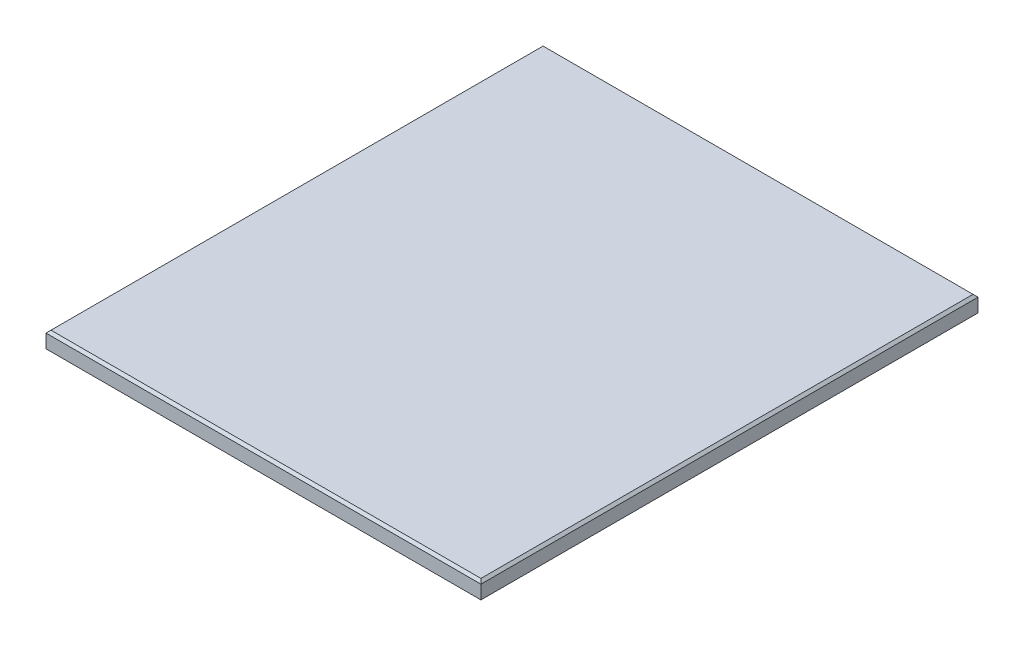
from build123d import *

# Parameters (mm, degrees)
SKETCH1_W           = 350
SKETCH1_H           = 400
BOSS_EXTRUDE1_DEPTH = 15
CHAMFER1_SIZE       = 2


with BuildPart() as part:
    # Sketch1 → Boss-Extrude1 (new body)
    with BuildSketch(Plane(origin=(0, 0, 0), x_dir=(1, 0, 0), z_dir=(0, 1, 0))):
        with Locations((175, -200)):
            Rectangle(SKETCH1_W, SKETCH1_H)
    extrude(amount=BOSS_EXTRUDE1_DEPTH)

    # Chamfer1
    chamfer1_edges = [part.edges().sort_by_distance(p)[0] for p in [
        (350, 15, 200),
        (175, 15, 0),
        (0, 15, 200),
        (175, 0, 0),
        (350, 0, 200),
        (175, 0, 400),
        (0, 0, 200),
        (175, 15, 400),
    ]]
    chamfer(chamfer1_edges, length=CHAMFER1_SIZE)


solid = part.part
